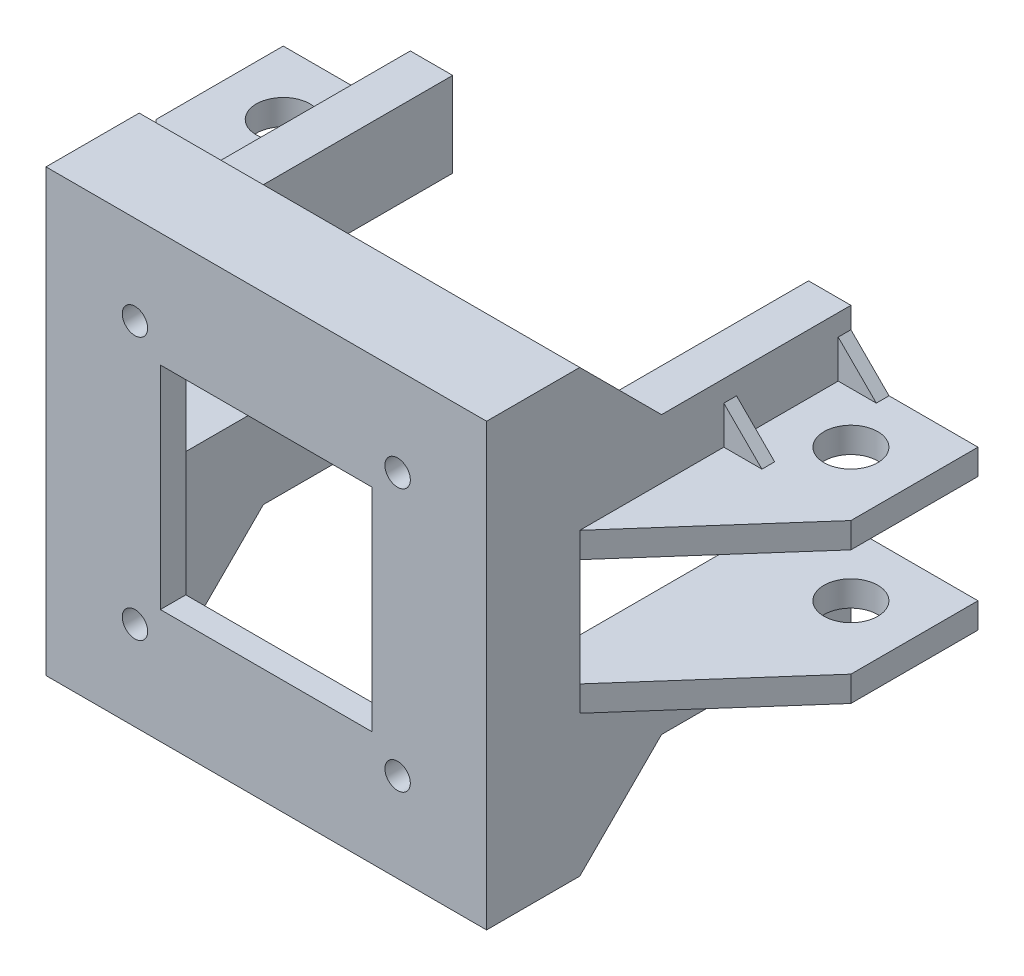
from build123d import *

# Parameters (mm, degrees)
SKETCH1_W                   = 52
SKETCH1_H                   = 52
SKETCH1_W_2                 = 42
SKETCH1_H_2                 = 42
BOSS_EXTRUDE1_DEPTH         = 8
SKETCH3_W                   = 5
SKETCH3_H                   = 10
BOSS_EXTRUDE3_DEPTH         = 32
SKETCH4_W                   = 15
SKETCH4_H                   = 3
BOSS_EXTRUDE4_DEPTH         = 15
MIRROR2_COPY_1_SKETCH_W     = 15
MIRROR2_COPY_1_SKETCH_H     = 3
MIRROR2_COPY_1_DEPTH        = 15
SKETCH2_W                   = 52
SKETCH2_H                   = 52
SKETCH2_W_2                 = 25
SKETCH2_H_2                 = 25
BOSS_EXTRUDE2_DEPTH         = 3
F_1_4_0_25_DIAMETER_HOLE1_D = 6.35
RIB1_REACH                  = 84.25
SKETCH9_WALL_W              = 180.146400996
SKETCH9_WALL_H              = 5
MIRROR5_COPY_1_REACH        = 84.25
MIRROR5_COPY_1_SKETCH_W     = 180.146400996
MIRROR5_COPY_1_SKETCH_H     = 5
F_3_0MM_DOWEL_HOLE1_D       = 3
BOSS_EXTRUDE5_DEPTH         = 1.5
BOSS_EXTRUDE6_START         = -15
BOSS_EXTRUDE6_DEPTH         = 1.5
MIRROR7_COPY_1_DEPTH        = 1.5
MIRROR7_START               = -15
MIRROR7_COPY_2_DEPTH        = 1.5
RIB12_REACH                 = 67.784
SKETCH13_WALL_W             = 156.23938331
SKETCH13_WALL_H             = 3
MIRROR9_COPY_1_REACH        = 67.784
MIRROR9_COPY_1_SKETCH_W     = 156.23938331
MIRROR9_COPY_1_SKETCH_H     = 3


with BuildPart() as part:
    # Sketch1 → Boss-Extrude1 (new body)
    with BuildSketch(Plane.XY):
        Rectangle(SKETCH1_W, SKETCH1_H)
        Rectangle(SKETCH1_W_2, SKETCH1_H_2, mode=Mode.SUBTRACT)
    extrude(amount=-BOSS_EXTRUDE1_DEPTH)

    # Sketch3 → Boss-Extrude3 (add)
    with BuildSketch(Plane(origin=(0, 0, -8), x_dir=(-1, 0, 0), z_dir=(0, 0, -1))):
        with Locations((-23.5, 11.35)):
            Rectangle(SKETCH3_W, SKETCH3_H)
        with Locations((-23.5, -11.35)):
            Rectangle(SKETCH3_W, SKETCH3_H)
    boss_extrude3 = extrude(amount=BOSS_EXTRUDE3_DEPTH)

    # Sketch4 → Boss-Extrude4 (add)
    with BuildSketch(Plane(origin=(26, 0, 0), x_dir=(0, 0, -1), z_dir=(1, 0, 0))):
        with Locations((32.5, -7.85)):
            Rectangle(SKETCH4_W, SKETCH4_H)
    boss_extrude4 = extrude(amount=BOSS_EXTRUDE4_DEPTH)

    # Mirror1: Boss-Extrude4 across plane
    add(boss_extrude4.mirror(Plane.ZX))

    # Mirror2: Boss-Extrude3, Boss-Extrude4 across plane
    add(boss_extrude3.mirror(Plane(origin=(0, 0, 0), x_dir=(0, 0, 1), z_dir=(1, 0, 0))))
    add(boss_extrude4.mirror(Plane(origin=(0, 0, 0), x_dir=(0, 0, 1), z_dir=(1, 0, 0))))

    # Mirror2 copy 1 sketch → Mirror2 copy 1 (add)
    with BuildSketch(Plane(origin=(-26, 0, 0), x_dir=(0, 0, -1), z_dir=(-1, 0, 0))):
        with Locations((32.5, -7.85)):
            Rectangle(MIRROR2_COPY_1_SKETCH_W, MIRROR2_COPY_1_SKETCH_H)
    extrude(amount=MIRROR2_COPY_1_DEPTH)

    # Sketch2 → Boss-Extrude2 (add)
    with BuildSketch(Plane.XY):
        Rectangle(SKETCH2_W, SKETCH2_H)
        Rectangle(SKETCH2_W_2, SKETCH2_H_2, mode=Mode.SUBTRACT)
    extrude(amount=BOSS_EXTRUDE2_DEPTH)

    # 1/4 (0.25) Diameter Hole1 (through all)
    with Locations(Plane(origin=(0, -9.35, 0), x_dir=(-1, 0, 0), z_dir=(0, -1, 0))):
        with Locations((33.5, 32.5)):
            f_1_4_0_25_diameter_hole1 = Hole(F_1_4_0_25_DIAMETER_HOLE1_D / 2)

    # Mirror3: 1/4 (0.25) Diameter Hole1 across plane
    add(f_1_4_0_25_diameter_hole1.mirror(Plane(origin=(0, 0, 0), x_dir=(0, 0, 1), z_dir=(1, 0, 0))), mode=Mode.SUBTRACT)

    # Sketch9 wall → Rib1 (add, up to next)
    with BuildSketch(Plane(origin=(-26, -21.175, -12.825), x_dir=(0, 0.707106781187, -0.707106781187), z_dir=(0, -0.707106781187, -0.707106781187)), mode=Mode.PRIVATE) as rib1_sk1:
        with Locations((0, 2.5)):
            Rectangle(SKETCH9_WALL_W, SKETCH9_WALL_H)
    rib1_tool1 = extrude(rib1_sk1.sketch, amount=-RIB1_REACH, mode=Mode.PRIVATE) - part.part
    rib1 = rib1_tool1.solids().sort_by_distance((-26, -21.175, -12.825))[0]
    add(rib1)

    # Mirror4: Rib1 across plane
    add(rib1.mirror(Plane.ZX))

    # Mirror5: Rib1 across plane
    add(rib1.mirror(Plane(origin=(0, 0, 0), x_dir=(0, 0, 1), z_dir=(1, 0, 0))))

    # Mirror5 copy 1 sketch → Mirror5 copy 1 (add, up to next)
    with BuildSketch(Plane(origin=(26, 21.175, -12.825), x_dir=(0, -0.707106781187, -0.707106781187), z_dir=(0, 0.707106781187, -0.707106781187)), mode=Mode.PRIVATE) as mirror5_copy_1_sk1:
        with Locations((0, 2.5)):
            Rectangle(MIRROR5_COPY_1_SKETCH_W, MIRROR5_COPY_1_SKETCH_H)
    mirror5_copy_1_tool1 = extrude(mirror5_copy_1_sk1.sketch, amount=-MIRROR5_COPY_1_REACH, mode=Mode.PRIVATE) - part.part
    add(mirror5_copy_1_tool1.solids().sort_by_distance((26, 21.175, -12.825))[0])

    # Ø3.0mm Dowel Hole1 (through all)
    with Locations(Plane(origin=(0, 0, 0), x_dir=(-1, 0, 0), z_dir=(0, 0, -1))):
        with Locations((15.5, -15.5), (-15.5, -15.5), (-15.5, 15.5), (15.5, 15.5)):
            Hole(F_3_0MM_DOWEL_HOLE1_D / 2)

    # Sketch12 → Boss-Extrude5 (add)
    with BuildSketch(Plane.XY.offset(-25)):
        Polygon((-30.5, -9.35), (-26, -13.85), (-26, -9.35), align=None)
    boss_extrude5 = extrude(amount=-BOSS_EXTRUDE5_DEPTH)

    # Sketch12<3> → Boss-Extrude6 (add)
    with BuildSketch(Plane.XY.offset(-25).offset(BOSS_EXTRUDE6_START)):
        Polygon((-30.5, -9.35), (-26, -13.85), (-26, -9.35), align=None)
    boss_extrude6 = extrude(amount=BOSS_EXTRUDE6_DEPTH)

    # Mirror6: Boss-Extrude5, Boss-Extrude6 across plane
    add(boss_extrude5.mirror(Plane(origin=(0, 0, 0), x_dir=(0, 0, 1), z_dir=(1, 0, 0))))
    add(boss_extrude6.mirror(Plane(origin=(0, 0, 0), x_dir=(0, 0, 1), z_dir=(1, 0, 0))))

    # Mirror7: Boss-Extrude5, Boss-Extrude6 across plane
    add(boss_extrude5.mirror(Plane.ZX))
    add(boss_extrude6.mirror(Plane.ZX))

    # Mirror7 copy 1 sketch → Mirror7 copy 1 (add)
    with BuildSketch(Plane(origin=(0, 0, -25), x_dir=(-1, 0, 0), z_dir=(0, 0, 1))):
        Polygon((-30.5, -9.35), (-26, -13.85), (-26, -9.35), align=None)
    extrude(amount=-MIRROR7_COPY_1_DEPTH)

    # Mirror7 copy 2 sketch → Mirror7 copy 2 (add)
    with BuildSketch(Plane(origin=(0, 0, -25), x_dir=(-1, 0, 0), z_dir=(0, 0, 1)).offset(MIRROR7_START)):
        Polygon((-30.5, -9.35), (-26, -13.85), (-26, -9.35), align=None)
    extrude(amount=MIRROR7_COPY_2_DEPTH)

    # Sketch13 wall → Rib12 (add, up to next)
    with BuildSketch(Plane(origin=(-33.5, -6.35, -16.5), x_dir=(-0.661621637087, 0, -0.749837855365), z_dir=(-0.749837855365, 0, 0.661621637087)), mode=Mode.PRIVATE) as rib12_sk1:
        with Locations((0, 1.5)):
            Rectangle(SKETCH13_WALL_W, SKETCH13_WALL_H)
    rib12_tool1 = extrude(rib12_sk1.sketch, amount=-RIB12_REACH, mode=Mode.PRIVATE) - part.part
    rib12 = rib12_tool1.solids().sort_by_distance((-33.5, -6.35, -16.5))[0]
    add(rib12)

    # Mirror8: Rib12 across plane
    add(rib12.mirror(Plane.ZX))

    # Mirror9: Rib12 across plane
    add(rib12.mirror(Plane(origin=(0, 0, 0), x_dir=(0, 0, 1), z_dir=(1, 0, 0))))

    # Mirror9 copy 1 sketch → Mirror9 copy 1 (add, up to next)
    with BuildSketch(Plane(origin=(33.5, 6.35, -16.5), x_dir=(0.661621637087, 0, -0.749837855365), z_dir=(0.749837855365, 0, 0.661621637087)), mode=Mode.PRIVATE) as mirror9_copy_1_sk1:
        with Locations((0, 1.5)):
            Rectangle(MIRROR9_COPY_1_SKETCH_W, MIRROR9_COPY_1_SKETCH_H)
    mirror9_copy_1_tool1 = extrude(mirror9_copy_1_sk1.sketch, amount=-MIRROR9_COPY_1_REACH, mode=Mode.PRIVATE) - part.part
    add(mirror9_copy_1_tool1.solids().sort_by_distance((33.5, 6.35, -16.5))[0])


solid = part.part
